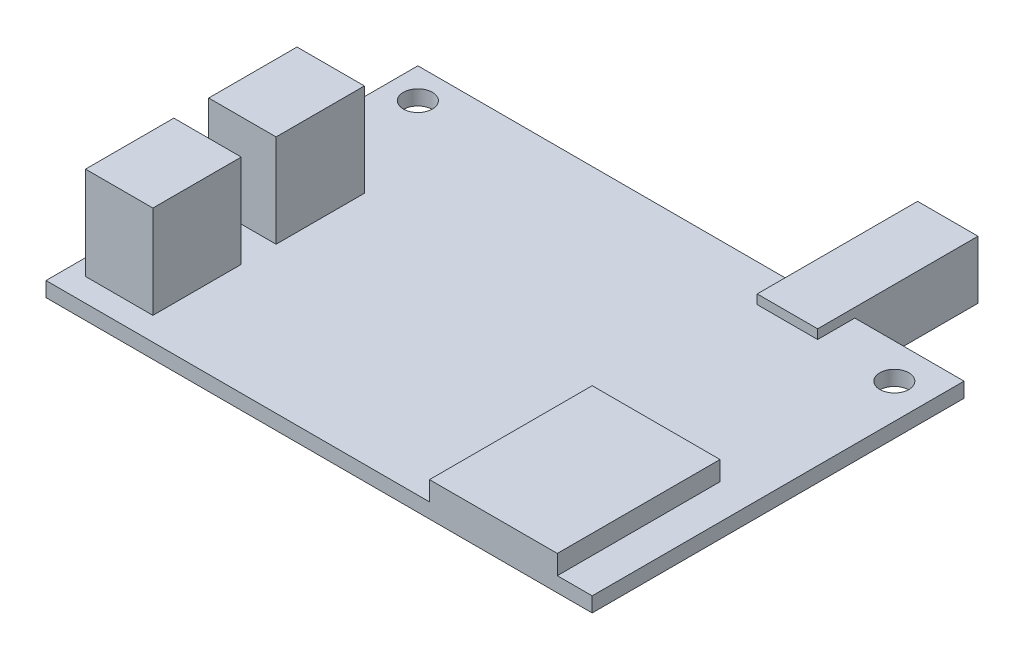
from build123d import *

# Parameters (mm, degrees)
SKETCH1_W           = 59.69
SKETCH1_H           = 40.64
SKETCH1_R           = 1.5875
BOSS_EXTRUDE1_DEPTH = 1.6256
SKETCH2_W           = 13.97
SKETCH2_H           = 17.78
BOSS_EXTRUDE2_DEPTH = 2.1082
BOSS_EXTRUDE3_START = 1.016
SKETCH3_W           = 6.604
SKETCH3_H           = 17.526
BOSS_EXTRUDE3_DEPTH = 6.35
SKETCH4_W           = 7.366
SKETCH4_H           = 9.652
BOSS_EXTRUDE4_DEPTH = 10.16


with BuildPart() as part:
    # Sketch1 → Boss-Extrude1 (new body)
    with BuildSketch(Plane(origin=(0, 0, 0), x_dir=(1, 0, 0), z_dir=(0, 1, 0))):
        Rectangle(SKETCH1_W, SKETCH1_H)
        with Locations(Location((26.035, 16.51, 0), (0, 0, 270))):
            Circle(SKETCH1_R, mode=Mode.SUBTRACT)
        with Locations(Location((-26.543, 17.018, 0), (0, 0, 270))):
            Circle(SKETCH1_R, mode=Mode.SUBTRACT)
    extrude(amount=BOSS_EXTRUDE1_DEPTH)

    # Sketch2 → Boss-Extrude2 (add)
    with BuildSketch(Plane(origin=(0, 1.6256, 0), x_dir=(1, 0, 0), z_dir=(0, 1, 0))):
        with Locations((19.05, -11.43)):
            Rectangle(SKETCH2_W, SKETCH2_H)
    extrude(amount=BOSS_EXTRUDE2_DEPTH)

    # Sketch3 → Boss-Extrude3 (add)
    with BuildSketch(Plane(origin=(0, 1.6256, 0), x_dir=(1, 0, 0), z_dir=(0, 1, 0)).offset(BOSS_EXTRUDE3_START)):
        with Locations((14.605, 25.019)):
            Rectangle(SKETCH3_W, SKETCH3_H)
    extrude(amount=-BOSS_EXTRUDE3_DEPTH)

    # Sketch4 → Boss-Extrude4 (add)
    with BuildSketch(Plane(origin=(0, 1.6256, 0), x_dir=(1, 0, 0), z_dir=(0, 1, 0))):
        with Locations((-24.384, -12.954)):
            Rectangle(SKETCH4_W, SKETCH4_H)
        with Locations((-24.384, 0.508)):
            Rectangle(SKETCH4_W, SKETCH4_H)
    extrude(amount=BOSS_EXTRUDE4_DEPTH)


solid = part.part
